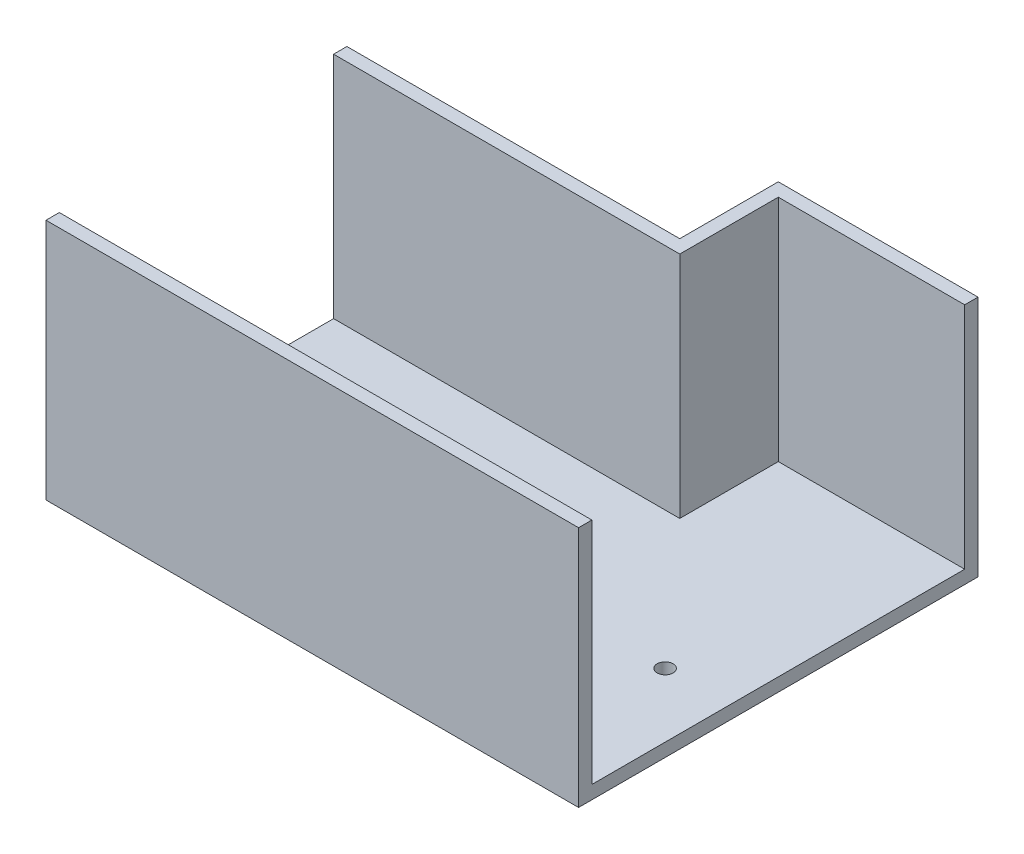
from build123d import *

# Parameters (mm, degrees)
SZKIC1_R                    = 3
DODANIE_WYCI_GNI_CIE1_DEPTH = 5
SZKIC1_4_W                  = 200
SZKIC1_4_H                  = 5
DODANIE_WYCI_GNI_CIE2_DEPTH = 86


with BuildPart() as part:
    # Szkic1 → Dodanie-wyciągnięcie1 (new body)
    with BuildSketch(Plane(origin=(0, 0, 0), x_dir=(1, 0, 0), z_dir=(0, 1, 0))):
        Polygon((91.234446081, 115), (16.234446081, 115), (16.234446081, 78), (-108.765553919, 78), (-108.765553919, -35), (91.234446081, -35), align=None)
        with Locations((67.234446081, 21.5)):
            Circle(SZKIC1_R, mode=Mode.SUBTRACT)
    extrude(amount=-DODANIE_WYCI_GNI_CIE1_DEPTH)

    # Szkic1<4> → Dodanie-wyciągnięcie2 (add)
    with BuildSketch(Plane(origin=(0, 0, 0), x_dir=(1, 0, 0), z_dir=(0, 1, 0))):
        with Locations((-8.765553919, -32.5)):
            Rectangle(SZKIC1_4_W, SZKIC1_4_H)
        Polygon((91.234446081, 110), (91.234446081, 115), (16.234446081, 115), (16.234446081, 78), (-108.765553919, 78), (-108.765553919, 73), (21.234446081, 73), (21.234446081, 110), align=None)
    extrude(amount=DODANIE_WYCI_GNI_CIE2_DEPTH)


solid = part.part
